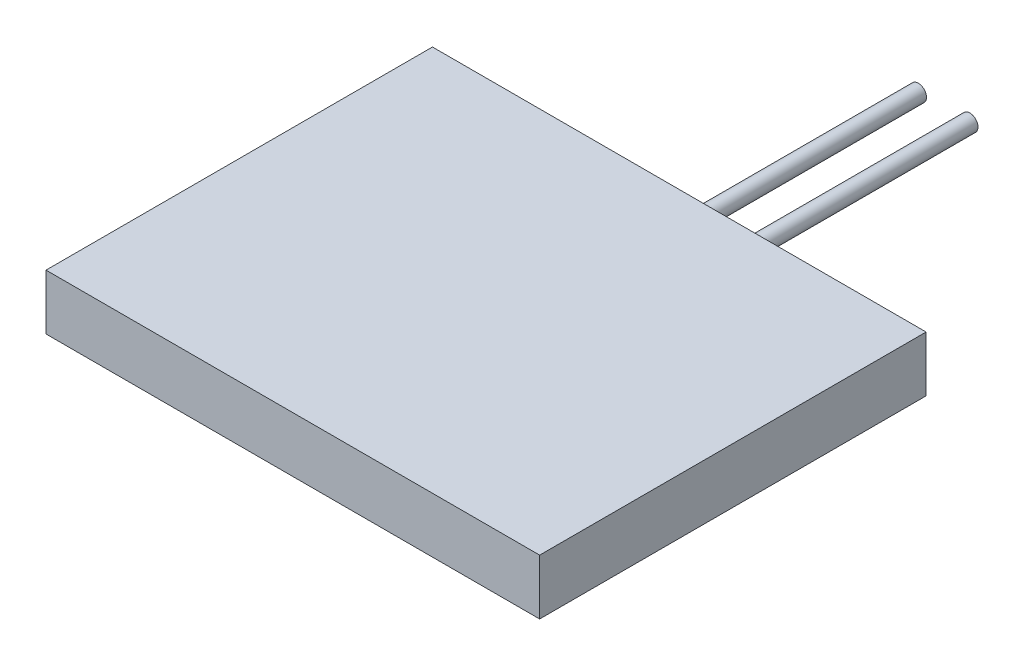
from build123d import *

# Parameters (mm, degrees)
SKETCH1_W           = 76.728670738
SKETCH1_H           = 60.068235585
BOSS_EXTRUDE1_DEPTH = 8.599843707
SKETCH2_R           = 1.27
BOSS_EXTRUDE2_DEPTH = 35.306


with BuildPart() as part:
    # Sketch1 → Boss-Extrude1 (new body)
    with BuildSketch(Plane(origin=(0, 0, 0), x_dir=(1, 0, 0), z_dir=(0, 1, 0))):
        with Locations((38.364335369, -30.034117793)):
            Rectangle(SKETCH1_W, SKETCH1_H)
    extrude(amount=BOSS_EXTRUDE1_DEPTH)

    # Sketch2 → Boss-Extrude2 (add)
    with BuildSketch(Plane(origin=(0, 0, 0), x_dir=(-1, 0, 0), z_dir=(0, 0, -1))):
        with Locations(Location((-48.21855473, 4.909861394, 0), (0, 0, 180))):
            Circle(SKETCH2_R)
        with Locations(Location((-40.214361226, 4.909861394, 0), (0, 0, 180))):
            Circle(SKETCH2_R)
    extrude(amount=BOSS_EXTRUDE2_DEPTH)


solid = part.part
